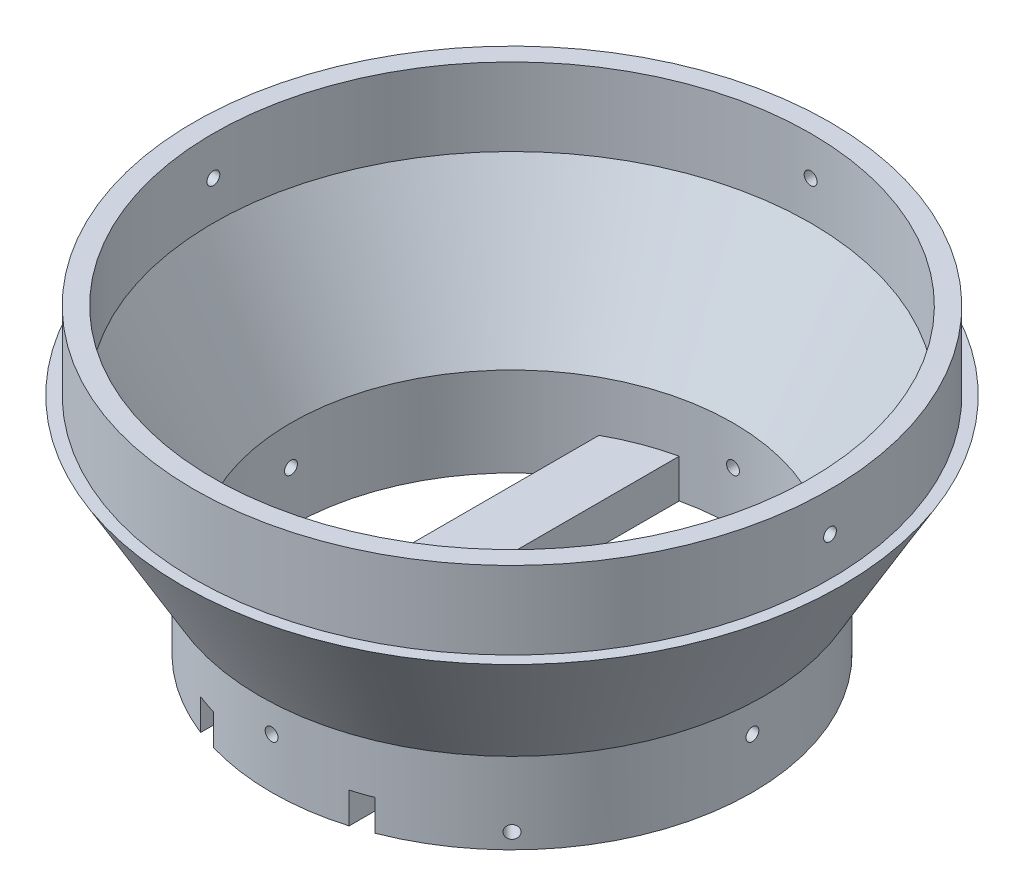
from build123d import *

# Parameters (mm, degrees)
BOSS_EXTRUDE1_REACH             = 134.044
SKETCH3_W                       = 15
SKETCH3_H                       = 10
BOSS_EXTRUDE1_DIRECTION_2_REACH = 134.044
CUT_EXTRUDE1_DEPTH              = 133.044085994
CUT_EXTRUDE1_DEPTH_BACK         = 133.044085994
SKETCH4_W                       = 5
SKETCH4_H                       = 8
M4_TAPPED_HOLE1_REACH           = 201.222
M4_TAPPED_HOLE1_BORE_R          = 1.65
M4_TAPPED_HOLE1_ON_FACE_2_REACH = 201.222
M4_TAPPED_HOLE1_BORE_2_R        = 1.65
M4_TAPPED_HOLE1_ON_FACE_3_REACH = 201.222
M4_TAPPED_HOLE1_BORE_3_R        = 1.65
M4_TAPPED_HOLE1_ON_FACE_4_REACH = 183.693
M4_TAPPED_HOLE1_BORE_4_R        = 1.65
M4_TAPPED_HOLE1_ON_FACE_5_REACH = 183.693
M4_TAPPED_HOLE1_BORE_5_R        = 1.65
M4_TAPPED_HOLE1_ON_FACE_6_REACH = 183.693
M4_TAPPED_HOLE1_BORE_6_R        = 1.65
M4_TAPPED_HOLE1_ON_FACE_7_REACH = 183.693
M4_TAPPED_HOLE1_BORE_7_R        = 1.65
M4_TAPPED_HOLE1_ON_FACE_8_REACH = 198.527
M4_TAPPED_HOLE1_BORE_8_R        = 1.65
M4_TAPPED_HOLE1_ON_FACE_9_REACH = 198.527
M4_TAPPED_HOLE1_BORE_9_R        = 1.65


with BuildPart() as part:
    # Sketch1 → Revolve1 (revolve)
    with BuildSketch(Plane.XY):
        Polygon((77, 54.641016151), (82, 54.641016151), (82, 34.641016151), (85, 34.641016151), (65, 0), (62, 0), (62, -23), (57, -23), (57, 0), (77, 34.641016151), align=None)
    revolve(axis=Axis((0, 0, 0), (0, 1, 0)))

    # Sketch3 → Boss-Extrude1 (add, up to next)
    with BuildSketch(Plane.XY, mode=Mode.PRIVATE) as boss_extrude1_sk1:
        with Locations((20, -18)):
            Rectangle(SKETCH3_W, SKETCH3_H)
    boss_extrude1_tool1 = extrude(boss_extrude1_sk1.sketch, amount=BOSS_EXTRUDE1_REACH, mode=Mode.PRIVATE) - part.part
    # Sketch3 → Boss-Extrude1 (add, up to next)
    with BuildSketch(Plane.XY, mode=Mode.PRIVATE) as boss_extrude1_sk2:
        with Locations((-20, -18)):
            Rectangle(SKETCH3_W, SKETCH3_H)
    boss_extrude1_tool2 = extrude(boss_extrude1_sk2.sketch, amount=BOSS_EXTRUDE1_REACH, mode=Mode.PRIVATE) - part.part
    add(boss_extrude1_tool1.solids().sort_by_distance((20, -18, 0))[0])
    add(boss_extrude1_tool2.solids().sort_by_distance((-20, -18, 0))[0])

    # Sketch3 → Boss-Extrude1 direction 2 (add, up to next)
    with BuildSketch(Plane.XY, mode=Mode.PRIVATE) as boss_extrude1_direction_2_sk1:
        with Locations((20, -18)):
            Rectangle(SKETCH3_W, SKETCH3_H)
    boss_extrude1_direction_2_tool1 = extrude(boss_extrude1_direction_2_sk1.sketch, amount=-BOSS_EXTRUDE1_DIRECTION_2_REACH, mode=Mode.PRIVATE) - part.part
    # Sketch3 → Boss-Extrude1 direction 2 (add, up to next)
    with BuildSketch(Plane.XY, mode=Mode.PRIVATE) as boss_extrude1_direction_2_sk2:
        with Locations((-20, -18)):
            Rectangle(SKETCH3_W, SKETCH3_H)
    boss_extrude1_direction_2_tool2 = extrude(boss_extrude1_direction_2_sk2.sketch, amount=-BOSS_EXTRUDE1_DIRECTION_2_REACH, mode=Mode.PRIVATE) - part.part
    add(boss_extrude1_direction_2_tool1.solids().sort_by_distance((20, -18, 0))[0])
    add(boss_extrude1_direction_2_tool2.solids().sort_by_distance((-20, -18, 0))[0])

    # Sketch4 → Cut-Extrude1 (cut, two sides: drawn at the far end of the back side and taken through both)
    with BuildSketch(Plane.XY.offset(-CUT_EXTRUDE1_DEPTH_BACK)):
        with Locations((-20, -19)):
            Rectangle(SKETCH4_W, SKETCH4_H)
        with Locations((20, -19)):
            Rectangle(SKETCH4_W, SKETCH4_H)
    extrude(amount=CUT_EXTRUDE1_DEPTH + CUT_EXTRUDE1_DEPTH_BACK, mode=Mode.SUBTRACT)

    # M4 Tapped Hole1 bore (on position points) → M4 Tapped Hole1 (cut, up to next)
    with BuildSketch(Plane(origin=(-82, 44.641016151, 0), x_dir=(0, 0, -1), z_dir=(-1, 0, 0)), mode=Mode.PRIVATE) as m4_tapped_hole1_sk1:
        Circle(M4_TAPPED_HOLE1_BORE_R)
    m4_tapped_hole1_tool1 = extrude(m4_tapped_hole1_sk1.sketch, amount=-M4_TAPPED_HOLE1_REACH, mode=Mode.PRIVATE) & part.part
    add(m4_tapped_hole1_tool1.solids().sort_by_distance((-82, 44.641016, 0))[0], mode=Mode.SUBTRACT)

    # M4 Tapped Hole1 bore 2 (on position points) → M4 Tapped Hole1 on face 2 (cut, up to next)
    with BuildSketch(Plane(origin=(0, 44.641016151, -82), x_dir=(-1, 0, 0), z_dir=(0, 0, -1)), mode=Mode.PRIVATE) as m4_tapped_hole1_on_face_2_sk1:
        Circle(M4_TAPPED_HOLE1_BORE_2_R)
    m4_tapped_hole1_on_face_2_tool1 = extrude(m4_tapped_hole1_on_face_2_sk1.sketch, amount=-M4_TAPPED_HOLE1_ON_FACE_2_REACH, mode=Mode.PRIVATE) & part.part
    add(m4_tapped_hole1_on_face_2_tool1.solids().sort_by_distance((0, 44.641016, -82))[0], mode=Mode.SUBTRACT)

    # M4 Tapped Hole1 bore 3 (on position points) → M4 Tapped Hole1 on face 3 (cut, up to next)
    with BuildSketch(Plane(origin=(82, 44.641016151, 0), x_dir=(0, 0, 1), z_dir=(1, 0, 0)), mode=Mode.PRIVATE) as m4_tapped_hole1_on_face_3_sk1:
        Circle(M4_TAPPED_HOLE1_BORE_3_R)
    m4_tapped_hole1_on_face_3_tool1 = extrude(m4_tapped_hole1_on_face_3_sk1.sketch, amount=-M4_TAPPED_HOLE1_ON_FACE_3_REACH, mode=Mode.PRIVATE) & part.part
    add(m4_tapped_hole1_on_face_3_tool1.solids().sort_by_distance((82, 44.641016, 0))[0], mode=Mode.SUBTRACT)

    # M4 Tapped Hole1 bore 4 (on position points) → M4 Tapped Hole1 on face 4 (cut, up to next)
    with BuildSketch(Plane(origin=(-62, -10, 0), x_dir=(0, 0, -1), z_dir=(-1, 0, 0)), mode=Mode.PRIVATE) as m4_tapped_hole1_on_face_4_sk1:
        Circle(M4_TAPPED_HOLE1_BORE_4_R)
    m4_tapped_hole1_on_face_4_tool1 = extrude(m4_tapped_hole1_on_face_4_sk1.sketch, amount=-M4_TAPPED_HOLE1_ON_FACE_4_REACH, mode=Mode.PRIVATE) & part.part
    add(m4_tapped_hole1_on_face_4_tool1.solids().sort_by_distance((-62, -10, 0))[0], mode=Mode.SUBTRACT)

    # M4 Tapped Hole1 bore 5 (on position points) → M4 Tapped Hole1 on face 5 (cut, up to next)
    with BuildSketch(Plane(origin=(0, -10, 62), x_dir=(1, 0, 0), z_dir=(0, 0, 1)), mode=Mode.PRIVATE) as m4_tapped_hole1_on_face_5_sk1:
        Circle(M4_TAPPED_HOLE1_BORE_5_R)
    m4_tapped_hole1_on_face_5_tool1 = extrude(m4_tapped_hole1_on_face_5_sk1.sketch, amount=-M4_TAPPED_HOLE1_ON_FACE_5_REACH, mode=Mode.PRIVATE) & part.part
    add(m4_tapped_hole1_on_face_5_tool1.solids().sort_by_distance((0, -10, 62))[0], mode=Mode.SUBTRACT)

    # M4 Tapped Hole1 bore 6 (on position points) → M4 Tapped Hole1 on face 6 (cut, up to next)
    with BuildSketch(Plane(origin=(62, -10, 0), x_dir=(0, 0, 1), z_dir=(1, 0, 0)), mode=Mode.PRIVATE) as m4_tapped_hole1_on_face_6_sk1:
        Circle(M4_TAPPED_HOLE1_BORE_6_R)
    m4_tapped_hole1_on_face_6_tool1 = extrude(m4_tapped_hole1_on_face_6_sk1.sketch, amount=-M4_TAPPED_HOLE1_ON_FACE_6_REACH, mode=Mode.PRIVATE) & part.part
    add(m4_tapped_hole1_on_face_6_tool1.solids().sort_by_distance((62, -10, 0))[0], mode=Mode.SUBTRACT)

    # M4 Tapped Hole1 bore 7 (on position points) → M4 Tapped Hole1 on face 7 (cut, up to next)
    with BuildSketch(Plane(origin=(0, -10, -62), x_dir=(-1, 0, 0), z_dir=(0, 0, -1)), mode=Mode.PRIVATE) as m4_tapped_hole1_on_face_7_sk1:
        Circle(M4_TAPPED_HOLE1_BORE_7_R)
    m4_tapped_hole1_on_face_7_tool1 = extrude(m4_tapped_hole1_on_face_7_sk1.sketch, amount=-M4_TAPPED_HOLE1_ON_FACE_7_REACH, mode=Mode.PRIVATE) & part.part
    add(m4_tapped_hole1_on_face_7_tool1.solids().sort_by_distance((0, -10, -62))[0], mode=Mode.SUBTRACT)

    # M4 Tapped Hole1 bore 8 (on position points) → M4 Tapped Hole1 on face 8 (cut, up to next)
    with BuildSketch(Plane(origin=(-43.840620434, -19, 43.840620434), x_dir=(0.707106781187, 0, 0.707106781187), z_dir=(-0.707106781187, 0, 0.707106781187)), mode=Mode.PRIVATE) as m4_tapped_hole1_on_face_8_sk1:
        Circle(M4_TAPPED_HOLE1_BORE_8_R)
    m4_tapped_hole1_on_face_8_tool1 = extrude(m4_tapped_hole1_on_face_8_sk1.sketch, amount=-M4_TAPPED_HOLE1_ON_FACE_8_REACH, mode=Mode.PRIVATE) & part.part
    add(m4_tapped_hole1_on_face_8_tool1.solids().sort_by_distance((-43.84062, -19, 43.84062))[0], mode=Mode.SUBTRACT)

    # M4 Tapped Hole1 bore 9 (on position points) → M4 Tapped Hole1 on face 9 (cut, up to next)
    with BuildSketch(Plane(origin=(43.840620434, -19, 43.840620434), x_dir=(0.707106781187, 0, -0.707106781187), z_dir=(0.707106781187, 0, 0.707106781187)), mode=Mode.PRIVATE) as m4_tapped_hole1_on_face_9_sk1:
        Circle(M4_TAPPED_HOLE1_BORE_9_R)
    m4_tapped_hole1_on_face_9_tool1 = extrude(m4_tapped_hole1_on_face_9_sk1.sketch, amount=-M4_TAPPED_HOLE1_ON_FACE_9_REACH, mode=Mode.PRIVATE) & part.part
    add(m4_tapped_hole1_on_face_9_tool1.solids().sort_by_distance((43.84062, -19, 43.84062))[0], mode=Mode.SUBTRACT)


solid = part.part
